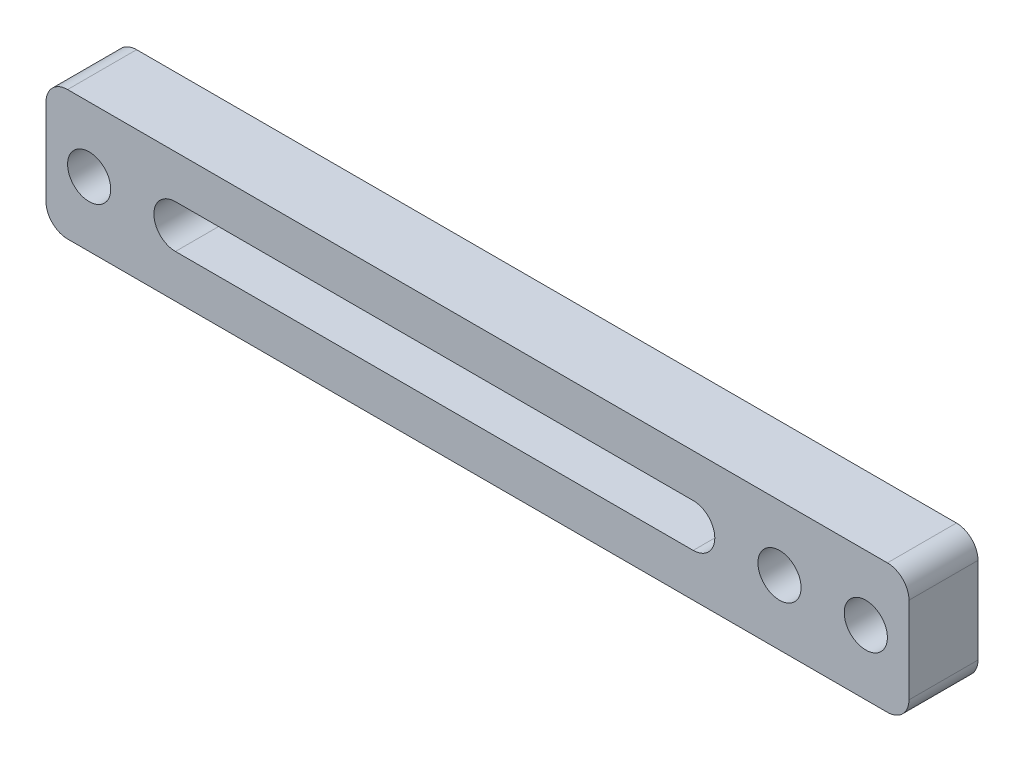
from build123d import *

# Parameters (mm, degrees)
SKETCH_1_W          = 100
SKETCH_1_H          = 15
EXTRUDE_1_DEPTH     = 8
SKETCH_2_R          = 2.5
CUT_EXTRUDE_2_DEPTH = 8
FILLET_2_R          = 2.5


with BuildPart() as part:
    # Эскиз1 → Вытянуть1 (new body)
    with BuildSketch(Plane.XY):
        with Locations((50, 7.5)):
            Rectangle(SKETCH_1_W, SKETCH_1_H)
    extrude(amount=EXTRUDE_1_DEPTH)

    # Эскиз2 → Вытянуть2 (cut)
    with BuildSketch(Plane.XY.offset(8)):
        with Locations((5, 7.5)):
            Circle(SKETCH_2_R)
        with Locations((95, 7.5)):
            Circle(SKETCH_2_R)
        with Locations((85, 7.5)):
            Circle(SKETCH_2_R)
        with BuildLine():
            Line((15, 10), (75, 10))
            ThreePointArc((75, 10), (77.5, 7.5), (75, 5))
            Line((75, 5), (15, 5))
            ThreePointArc((15, 5), (12.5, 7.5), (15, 10))
        make_face()
    extrude(amount=-CUT_EXTRUDE_2_DEPTH, mode=Mode.SUBTRACT)

    # Скругление2
    fillet_2_edges = [part.edges().sort_by_distance(p)[0] for p in [
        (0, 15, 4),
        (100, 15, 4),
        (100, 0, 4),
        (0, 0, 4),
    ]]
    fillet(fillet_2_edges, radius=FILLET_2_R)


solid = part.part
